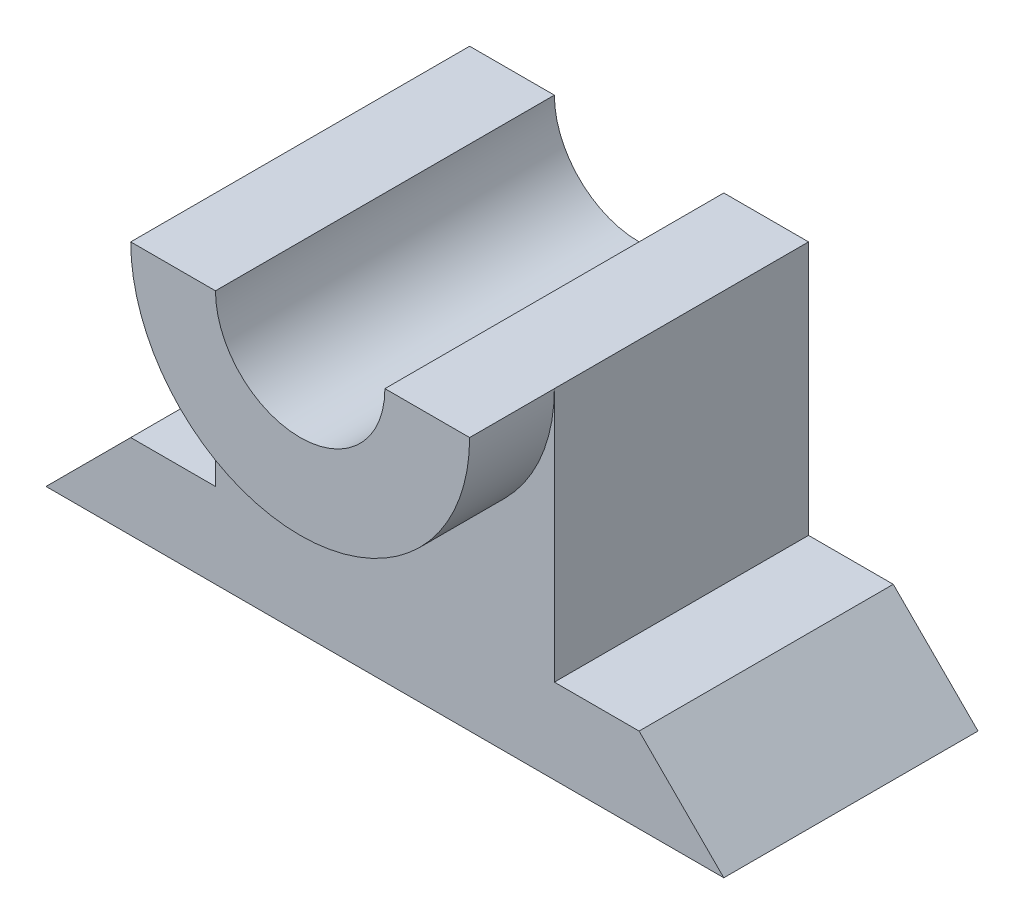
from build123d import *

# Parameters (mm, degrees)
BOSS_EXTRUDE2_DEPTH = 30
BOSS_EXTRUDE9_DEPTH = 10
SKETCH12_R          = 10
CUT_EXTRUDE8_DEPTH  = 40


with BuildPart() as part:
    # Sketch2 → Boss-Extrude2 (new body)
    with BuildSketch(Plane.XY):
        Polygon((0, 0), (80, 0), (70, 10), (60, 10), (60, 40), (20, 40), (20, 10), (10, 10), align=None)
    extrude(amount=-BOSS_EXTRUDE2_DEPTH)

    # Sketch4 → Boss-Extrude9 (add)
    with BuildSketch(Plane.XY):
        with BuildLine():
            Line((20, 40), (60, 40))
            ThreePointArc((60, 40), (40, 20), (20, 40))
        make_face()
    extrude(amount=BOSS_EXTRUDE9_DEPTH)

    # Sketch12 → Cut-Extrude8 (cut)
    with BuildSketch(Plane.XY.offset(10)):
        with Locations((40, 40)):
            Circle(SKETCH12_R)
    extrude(amount=-CUT_EXTRUDE8_DEPTH, mode=Mode.SUBTRACT)


solid = part.part
